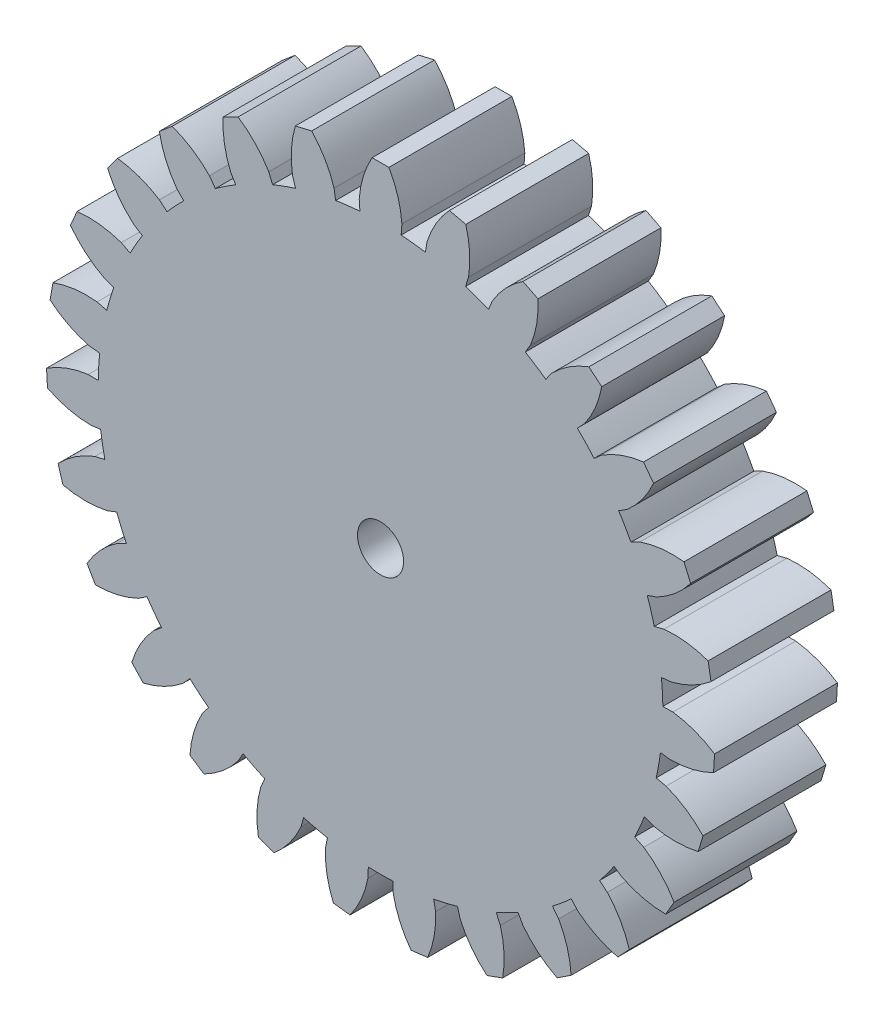
from build123d import *

# Parameters (mm, degrees)
SKETCH2_R           = 18.375
BOSS_EXTRUDE1_DEPTH = 8
BOSS_EXTRUDE2_DEPTH = 8
CIRPATTERN1_COUNT   = 27
SKETCH6_R           = 1.5
CUT_EXTRUDE1_DEPTH  = 8


with BuildPart() as part:
    # Sketch2 → Boss-Extrude1 (new body)
    with BuildSketch(Plane.XY):
        Circle(SKETCH2_R)
    extrude(amount=BOSS_EXTRUDE1_DEPTH)

    # Sketch3 → Boss-Extrude2 (add)
    with BuildSketch(Plane.XY):
        with BuildLine():
            Line((0, 0), (1.389343669, 18.978212908))
            ThreePointArc((1.389343669, 18.978212908), (1.123636729, 20.408374385), (0.545441107, 21.743159706))
            Line((0.545441107, 21.743159706), (-0.545441107, 21.743159706))
            ThreePointArc((-0.545441107, 21.743159706), (-1.123636729, 20.408374385), (-1.389343669, 18.978212908))
            Line((-1.389343669, 18.978212908), (0, 0))
        make_face()
    boss_extrude2 = extrude(amount=BOSS_EXTRUDE2_DEPTH)

    # CirPattern1: Boss-Extrude2 ×27 about axis
    cirpattern1_axis = Axis((0, 0, 0), (0, 0, 1))
    for i in range(1, CIRPATTERN1_COUNT):
        add(boss_extrude2.rotate(cirpattern1_axis, i * 360 / CIRPATTERN1_COUNT))

    # Sketch6 → Cut-Extrude1 (cut)
    with BuildSketch(Plane.XY.offset(8)):
        Circle(SKETCH6_R)
    extrude(amount=-CUT_EXTRUDE1_DEPTH, mode=Mode.SUBTRACT)


solid = part.part
